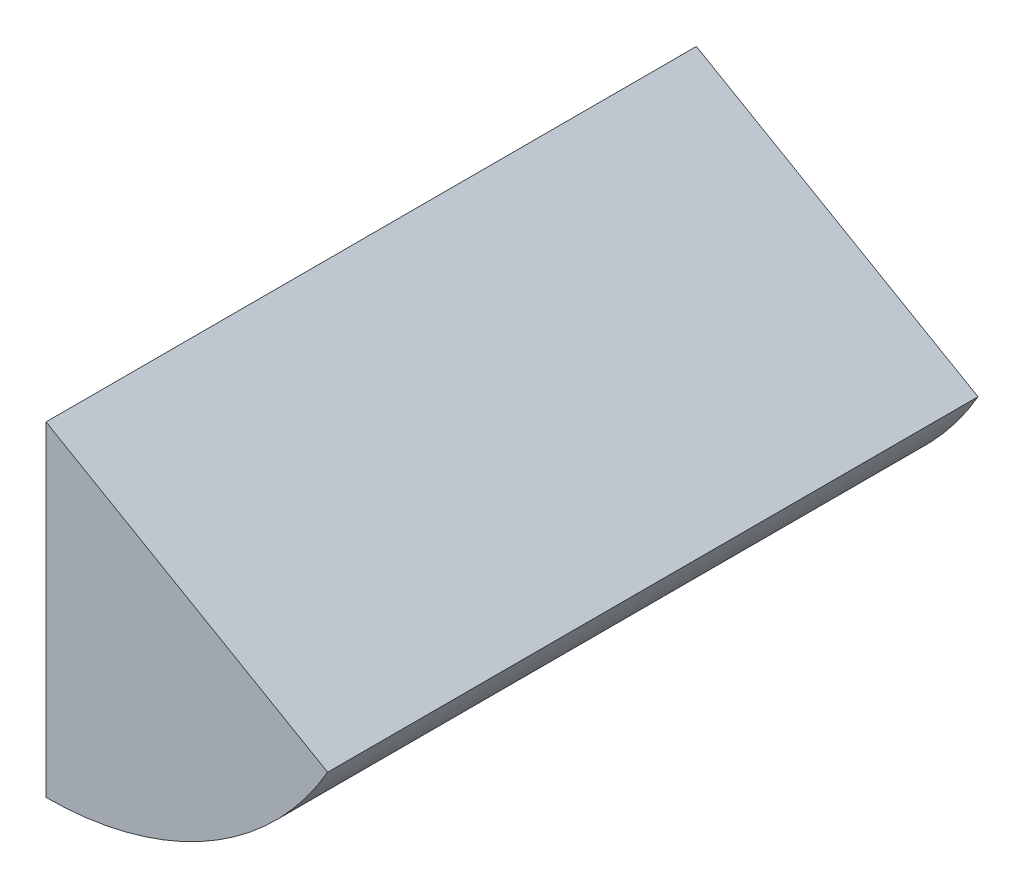
from build123d import *

# Parameters (mm, degrees)
SALIENTE_EXTRUIR1_DEPTH = 50
CROQUIS2_R              = 5
CORTAR_EXTRUIR1_DEPTH   = 10


with BuildPart() as part:
    # Croquis1 → Saliente-Extruir1 (new body)
    with BuildSketch(Plane.XY):
        with BuildLine():
            Line((0, 0), (0, -25))
            ThreePointArc((0, -25), (12.5, -21.650635095), (21.650635095, -12.5))
            Line((21.650635095, -12.5), (0, 0))
        make_face()
    extrude(amount=SALIENTE_EXTRUIR1_DEPTH)

    # Croquis2 → Cortar-Extruir1 (cut)
    with BuildSketch(Plane(origin=(0, 0, 0), x_dir=(-1, 0, 0), z_dir=(0, 0, -1))):
        with Locations((-7.991809709, -13.850442103)):
            Circle(CROQUIS2_R)
    extrude(amount=-CORTAR_EXTRUIR1_DEPTH, mode=Mode.SUBTRACT)


solid = part.part
